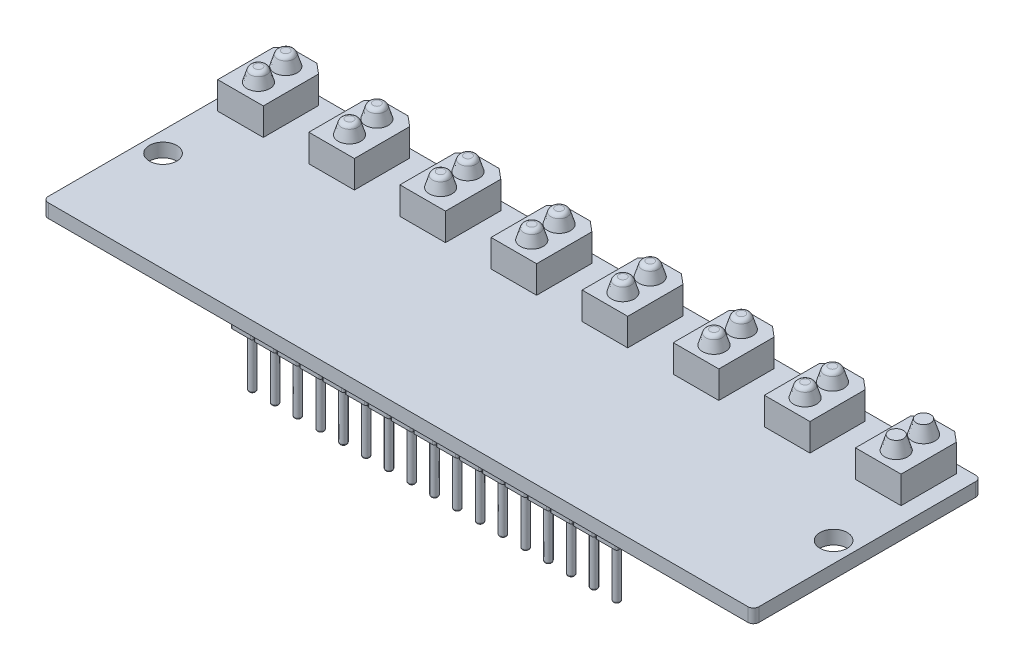
from build123d import *

# Parameters (mm, degrees)
SKETCH1_W                      = 78
SKETCH1_H                      = 25
BOSS_EXTRUDE1_DEPTH            = 1.5
FILLET1_R                      = 0.6
SKETCH2_R                      = 1.5
CUT_EXTRUDE1_DEPTH             = 1.5
BOSS_EXTRUDE2_DEPTH            = 3
SKETCH4_R                      = 1.25
BOSS_EXTRUDE7_DEPTH            = 1.5
BOSS_EXTRUDE7_DRAFT            = 17
BOSS_EXTRUDE7_PROFILE_2_DEPTH  = 1.5
BOSS_EXTRUDE7_PROFILE_2_DRAFT  = 17
BOSS_EXTRUDE7_PROFILE_3_DEPTH  = 1.5
BOSS_EXTRUDE7_PROFILE_3_DRAFT  = 17
BOSS_EXTRUDE7_PROFILE_4_DEPTH  = 1.5
BOSS_EXTRUDE7_PROFILE_4_DRAFT  = 17
BOSS_EXTRUDE7_PROFILE_5_DEPTH  = 1.5
BOSS_EXTRUDE7_PROFILE_5_DRAFT  = 17
BOSS_EXTRUDE7_PROFILE_6_DEPTH  = 1.5
BOSS_EXTRUDE7_PROFILE_6_DRAFT  = 17
BOSS_EXTRUDE7_PROFILE_7_DEPTH  = 1.5
BOSS_EXTRUDE7_PROFILE_7_DRAFT  = 17
BOSS_EXTRUDE7_PROFILE_8_DEPTH  = 1.5
BOSS_EXTRUDE7_PROFILE_8_DRAFT  = 17
BOSS_EXTRUDE7_PROFILE_9_DEPTH  = 1.5
BOSS_EXTRUDE7_PROFILE_9_DRAFT  = 17
BOSS_EXTRUDE7_PROFILE_10_DEPTH = 1.5
BOSS_EXTRUDE7_PROFILE_10_DRAFT = 17
BOSS_EXTRUDE7_PROFILE_11_DEPTH = 1.5
BOSS_EXTRUDE7_PROFILE_11_DRAFT = 17
BOSS_EXTRUDE7_PROFILE_12_DEPTH = 1.5
BOSS_EXTRUDE7_PROFILE_12_DRAFT = 17
BOSS_EXTRUDE7_PROFILE_13_DEPTH = 1.5
BOSS_EXTRUDE7_PROFILE_13_DRAFT = 17
BOSS_EXTRUDE7_PROFILE_14_DEPTH = 1.5
BOSS_EXTRUDE7_PROFILE_14_DRAFT = 17
BOSS_EXTRUDE7_PROFILE_15_DEPTH = 1.5
BOSS_EXTRUDE7_PROFILE_15_DRAFT = 17
BOSS_EXTRUDE7_PROFILE_16_DEPTH = 1.5
BOSS_EXTRUDE7_PROFILE_16_DRAFT = 17
FILLET4_R                      = 0.5
SKETCH5_W                      = 2.4
SKETCH5_H                      = 2.4
BOSS_EXTRUDE12_DEPTH           = 2
SKETCH6_R                      = 0.375
BOSS_EXTRUDE13_DEPTH           = 6
FILLET5_R                      = 0.2
FILLET7_R                      = 0.2
FILLET8_R                      = 0.2


with BuildPart() as part:
    # Sketch1 → Boss-Extrude1 (new body)
    with BuildSketch(Plane(origin=(0, 0, 0), x_dir=(1, 0, 0), z_dir=(0, 1, 0))):
        Rectangle(SKETCH1_W, SKETCH1_H)
    extrude(amount=BOSS_EXTRUDE1_DEPTH)

    # Fillet1
    fillet1_edges = [part.edges().sort_by_distance(p)[0] for p in [
        (-39, 0.75, -12.5),
        (39, 0.75, -12.5),
        (39, 0.75, 12.5),
        (-39, 0.75, 12.5),
    ]]
    fillet(fillet1_edges, radius=FILLET1_R)

    # Sketch2 → Cut-Extrude1 (cut)
    with BuildSketch(Plane(origin=(0, 1.5, 0), x_dir=(1, 0, 0), z_dir=(0, 1, 0))):
        with Locations(Location((-36.8, -1.5, 0), (0, 0, 270))):
            Circle(SKETCH2_R)
        with Locations(Location((36.8, -1.5, 0), (0, 0, 90))):
            Circle(SKETCH2_R)
    extrude(amount=-CUT_EXTRUDE1_DEPTH, mode=Mode.SUBTRACT)

    # Sketch3 → Boss-Extrude2 (add)
    with BuildSketch(Plane(origin=(0, 1.5, 0), x_dir=(1, 0, 0), z_dir=(0, 1, 0))):
        Polygon((-36.866761268, 12.5), (-33.913958089, 12.5), (-32.8, 11.566761268), (-32.8, 5.5), (-37.8, 5.5), (-37.8, 11.566761268), align=None)
        Polygon((-22.8, 11.566761268), (-22.8, 5.5), (-27.8, 5.5), (-27.8, 11.566761268), (-26.866761268, 12.5), (-23.913958089, 12.5), align=None)
        Polygon((-12.8, 11.566761268), (-12.8, 5.5), (-17.8, 5.5), (-17.8, 11.566761268), (-16.866761268, 12.5), (-13.913958089, 12.5), align=None)
        Polygon((-2.8, 11.566761268), (-2.8, 5.5), (-7.8, 5.5), (-7.8, 11.566761268), (-6.866761268, 12.5), (-3.913958089, 12.5), align=None)
        Polygon((7.2, 11.566761268), (7.2, 5.5), (2.2, 5.5), (2.2, 11.566761268), (3.133238732, 12.5), (6.086041911, 12.5), align=None)
        Polygon((17.2, 11.566761268), (17.2, 5.5), (12.2, 5.5), (12.2, 11.566761268), (13.133238732, 12.5), (16.086041911, 12.5), align=None)
        Polygon((27.2, 11.566761268), (27.2, 5.5), (22.2, 5.5), (22.2, 11.566761268), (23.133238732, 12.5), (26.086041911, 12.5), align=None)
        Polygon((37.2, 11.566761268), (37.2, 5.5), (32.2, 5.5), (32.2, 11.566761268), (33.133238732, 12.5), (36.086041911, 12.5), align=None)
    extrude(amount=BOSS_EXTRUDE2_DEPTH)


with BuildPart() as boss_extrude7_tool:
    # Sketch4 → Boss-Extrude7 (with draft: the straight prism first)
    with BuildSketch(Plane(origin=(0, 4.5, 0), x_dir=(1, 0, 0), z_dir=(0, 1, 0))):
        with Locations((-35.33, 10.499601384)):
            Circle(SKETCH4_R)
    extrude(amount=BOSS_EXTRUDE7_DEPTH)
    # Boss-Extrude7: the draft: its side faces are tilted about the plane it starts from
    boss_extrude7_sides = [boss_extrude7_tool.faces().sort_by_distance(p)[0] for p in [
        (-36.58, 5.25, -10.499601384),
    ]]
    draft(boss_extrude7_sides, Plane(origin=(0, 4.5, 0), x_dir=(1, 0, 0), z_dir=(0, 1, 0)), BOSS_EXTRUDE7_DRAFT)


with BuildPart() as part_1:
    add(part.part)

    # Boss-Extrude7: add boss_extrude7_tool
    add(boss_extrude7_tool.part)


with BuildPart() as boss_extrude7_profile_2_tool:
    # Sketch4 → Boss-Extrude7 profile 2 (with draft: the straight prism first)
    with BuildSketch(Plane(origin=(0, 4.5, 0), x_dir=(1, 0, 0), z_dir=(0, 1, 0))):
        with Locations((-35.33, 7.5)):
            Circle(SKETCH4_R)
    extrude(amount=BOSS_EXTRUDE7_PROFILE_2_DEPTH)
    # Boss-Extrude7 profile 2: the draft: its side faces are tilted about the plane it starts from
    boss_extrude7_profile_2_sides = [boss_extrude7_profile_2_tool.faces().sort_by_distance(p)[0] for p in [
        (-36.58, 5.25, -7.5),
    ]]
    draft(boss_extrude7_profile_2_sides, Plane(origin=(0, 4.5, 0), x_dir=(1, 0, 0), z_dir=(0, 1, 0)), BOSS_EXTRUDE7_PROFILE_2_DRAFT)


with BuildPart() as part_2:
    add(part_1.part)

    # Boss-Extrude7 profile 2: add boss_extrude7_profile_2_tool
    add(boss_extrude7_profile_2_tool.part)


with BuildPart() as boss_extrude7_profile_3_tool:
    # Sketch4 → Boss-Extrude7 profile 3 (with draft: the straight prism first)
    with BuildSketch(Plane(origin=(0, 4.5, 0), x_dir=(1, 0, 0), z_dir=(0, 1, 0))):
        with Locations((-25.33, 10.499601384)):
            Circle(SKETCH4_R)
    extrude(amount=BOSS_EXTRUDE7_PROFILE_3_DEPTH)
    # Boss-Extrude7 profile 3: the draft: its side faces are tilted about the plane it starts from
    boss_extrude7_profile_3_sides = [boss_extrude7_profile_3_tool.faces().sort_by_distance(p)[0] for p in [
        (-26.58, 5.25, -10.499601384),
    ]]
    draft(boss_extrude7_profile_3_sides, Plane(origin=(0, 4.5, 0), x_dir=(1, 0, 0), z_dir=(0, 1, 0)), BOSS_EXTRUDE7_PROFILE_3_DRAFT)


with BuildPart() as part_3:
    add(part_2.part)

    # Boss-Extrude7 profile 3: add boss_extrude7_profile_3_tool
    add(boss_extrude7_profile_3_tool.part)


with BuildPart() as boss_extrude7_profile_4_tool:
    # Sketch4 → Boss-Extrude7 profile 4 (with draft: the straight prism first)
    with BuildSketch(Plane(origin=(0, 4.5, 0), x_dir=(1, 0, 0), z_dir=(0, 1, 0))):
        with Locations((-25.33, 7.5)):
            Circle(SKETCH4_R)
    extrude(amount=BOSS_EXTRUDE7_PROFILE_4_DEPTH)
    # Boss-Extrude7 profile 4: the draft: its side faces are tilted about the plane it starts from
    boss_extrude7_profile_4_sides = [boss_extrude7_profile_4_tool.faces().sort_by_distance(p)[0] for p in [
        (-26.58, 5.25, -7.5),
    ]]
    draft(boss_extrude7_profile_4_sides, Plane(origin=(0, 4.5, 0), x_dir=(1, 0, 0), z_dir=(0, 1, 0)), BOSS_EXTRUDE7_PROFILE_4_DRAFT)


with BuildPart() as part_4:
    add(part_3.part)

    # Boss-Extrude7 profile 4: add boss_extrude7_profile_4_tool
    add(boss_extrude7_profile_4_tool.part)


with BuildPart() as boss_extrude7_profile_5_tool:
    # Sketch4 → Boss-Extrude7 profile 5 (with draft: the straight prism first)
    with BuildSketch(Plane(origin=(0, 4.5, 0), x_dir=(1, 0, 0), z_dir=(0, 1, 0))):
        with Locations((-15.33, 10.499601384)):
            Circle(SKETCH4_R)
    extrude(amount=BOSS_EXTRUDE7_PROFILE_5_DEPTH)
    # Boss-Extrude7 profile 5: the draft: its side faces are tilted about the plane it starts from
    boss_extrude7_profile_5_sides = [boss_extrude7_profile_5_tool.faces().sort_by_distance(p)[0] for p in [
        (-16.58, 5.25, -10.499601384),
    ]]
    draft(boss_extrude7_profile_5_sides, Plane(origin=(0, 4.5, 0), x_dir=(1, 0, 0), z_dir=(0, 1, 0)), BOSS_EXTRUDE7_PROFILE_5_DRAFT)


with BuildPart() as part_5:
    add(part_4.part)

    # Boss-Extrude7 profile 5: add boss_extrude7_profile_5_tool
    add(boss_extrude7_profile_5_tool.part)


with BuildPart() as boss_extrude7_profile_6_tool:
    # Sketch4 → Boss-Extrude7 profile 6 (with draft: the straight prism first)
    with BuildSketch(Plane(origin=(0, 4.5, 0), x_dir=(1, 0, 0), z_dir=(0, 1, 0))):
        with Locations((-15.33, 7.5)):
            Circle(SKETCH4_R)
    extrude(amount=BOSS_EXTRUDE7_PROFILE_6_DEPTH)
    # Boss-Extrude7 profile 6: the draft: its side faces are tilted about the plane it starts from
    boss_extrude7_profile_6_sides = [boss_extrude7_profile_6_tool.faces().sort_by_distance(p)[0] for p in [
        (-16.58, 5.25, -7.5),
    ]]
    draft(boss_extrude7_profile_6_sides, Plane(origin=(0, 4.5, 0), x_dir=(1, 0, 0), z_dir=(0, 1, 0)), BOSS_EXTRUDE7_PROFILE_6_DRAFT)


with BuildPart() as part_6:
    add(part_5.part)

    # Boss-Extrude7 profile 6: add boss_extrude7_profile_6_tool
    add(boss_extrude7_profile_6_tool.part)


with BuildPart() as boss_extrude7_profile_7_tool:
    # Sketch4 → Boss-Extrude7 profile 7 (with draft: the straight prism first)
    with BuildSketch(Plane(origin=(0, 4.5, 0), x_dir=(1, 0, 0), z_dir=(0, 1, 0))):
        with Locations((-5.33, 10.499601384)):
            Circle(SKETCH4_R)
    extrude(amount=BOSS_EXTRUDE7_PROFILE_7_DEPTH)
    # Boss-Extrude7 profile 7: the draft: its side faces are tilted about the plane it starts from
    boss_extrude7_profile_7_sides = [boss_extrude7_profile_7_tool.faces().sort_by_distance(p)[0] for p in [
        (-6.58, 5.25, -10.499601384),
    ]]
    draft(boss_extrude7_profile_7_sides, Plane(origin=(0, 4.5, 0), x_dir=(1, 0, 0), z_dir=(0, 1, 0)), BOSS_EXTRUDE7_PROFILE_7_DRAFT)


with BuildPart() as part_7:
    add(part_6.part)

    # Boss-Extrude7 profile 7: add boss_extrude7_profile_7_tool
    add(boss_extrude7_profile_7_tool.part)


with BuildPart() as boss_extrude7_profile_8_tool:
    # Sketch4 → Boss-Extrude7 profile 8 (with draft: the straight prism first)
    with BuildSketch(Plane(origin=(0, 4.5, 0), x_dir=(1, 0, 0), z_dir=(0, 1, 0))):
        with Locations((-5.33, 7.5)):
            Circle(SKETCH4_R)
    extrude(amount=BOSS_EXTRUDE7_PROFILE_8_DEPTH)
    # Boss-Extrude7 profile 8: the draft: its side faces are tilted about the plane it starts from
    boss_extrude7_profile_8_sides = [boss_extrude7_profile_8_tool.faces().sort_by_distance(p)[0] for p in [
        (-6.58, 5.25, -7.5),
    ]]
    draft(boss_extrude7_profile_8_sides, Plane(origin=(0, 4.5, 0), x_dir=(1, 0, 0), z_dir=(0, 1, 0)), BOSS_EXTRUDE7_PROFILE_8_DRAFT)


with BuildPart() as part_8:
    add(part_7.part)

    # Boss-Extrude7 profile 8: add boss_extrude7_profile_8_tool
    add(boss_extrude7_profile_8_tool.part)


with BuildPart() as boss_extrude7_profile_9_tool:
    # Sketch4 → Boss-Extrude7 profile 9 (with draft: the straight prism first)
    with BuildSketch(Plane(origin=(0, 4.5, 0), x_dir=(1, 0, 0), z_dir=(0, 1, 0))):
        with Locations((4.67, 10.499601384)):
            Circle(SKETCH4_R)
    extrude(amount=BOSS_EXTRUDE7_PROFILE_9_DEPTH)
    # Boss-Extrude7 profile 9: the draft: its side faces are tilted about the plane it starts from
    boss_extrude7_profile_9_sides = [boss_extrude7_profile_9_tool.faces().sort_by_distance(p)[0] for p in [
        (3.42, 5.25, -10.499601384),
    ]]
    draft(boss_extrude7_profile_9_sides, Plane(origin=(0, 4.5, 0), x_dir=(1, 0, 0), z_dir=(0, 1, 0)), BOSS_EXTRUDE7_PROFILE_9_DRAFT)


with BuildPart() as part_9:
    add(part_8.part)

    # Boss-Extrude7 profile 9: add boss_extrude7_profile_9_tool
    add(boss_extrude7_profile_9_tool.part)


with BuildPart() as boss_extrude7_profile_10_tool:
    # Sketch4 → Boss-Extrude7 profile 10 (with draft: the straight prism first)
    with BuildSketch(Plane(origin=(0, 4.5, 0), x_dir=(1, 0, 0), z_dir=(0, 1, 0))):
        with Locations((4.67, 7.5)):
            Circle(SKETCH4_R)
    extrude(amount=BOSS_EXTRUDE7_PROFILE_10_DEPTH)
    # Boss-Extrude7 profile 10: the draft: its side faces are tilted about the plane it starts from
    boss_extrude7_profile_10_sides = [boss_extrude7_profile_10_tool.faces().sort_by_distance(p)[0] for p in [
        (3.42, 5.25, -7.5),
    ]]
    draft(boss_extrude7_profile_10_sides, Plane(origin=(0, 4.5, 0), x_dir=(1, 0, 0), z_dir=(0, 1, 0)), BOSS_EXTRUDE7_PROFILE_10_DRAFT)


with BuildPart() as part_10:
    add(part_9.part)

    # Boss-Extrude7 profile 10: add boss_extrude7_profile_10_tool
    add(boss_extrude7_profile_10_tool.part)


with BuildPart() as boss_extrude7_profile_11_tool:
    # Sketch4 → Boss-Extrude7 profile 11 (with draft: the straight prism first)
    with BuildSketch(Plane(origin=(0, 4.5, 0), x_dir=(1, 0, 0), z_dir=(0, 1, 0))):
        with Locations((14.67, 10.499601384)):
            Circle(SKETCH4_R)
    extrude(amount=BOSS_EXTRUDE7_PROFILE_11_DEPTH)
    # Boss-Extrude7 profile 11: the draft: its side faces are tilted about the plane it starts from
    boss_extrude7_profile_11_sides = [boss_extrude7_profile_11_tool.faces().sort_by_distance(p)[0] for p in [
        (13.42, 5.25, -10.499601384),
    ]]
    draft(boss_extrude7_profile_11_sides, Plane(origin=(0, 4.5, 0), x_dir=(1, 0, 0), z_dir=(0, 1, 0)), BOSS_EXTRUDE7_PROFILE_11_DRAFT)


with BuildPart() as part_11:
    add(part_10.part)

    # Boss-Extrude7 profile 11: add boss_extrude7_profile_11_tool
    add(boss_extrude7_profile_11_tool.part)


with BuildPart() as boss_extrude7_profile_12_tool:
    # Sketch4 → Boss-Extrude7 profile 12 (with draft: the straight prism first)
    with BuildSketch(Plane(origin=(0, 4.5, 0), x_dir=(1, 0, 0), z_dir=(0, 1, 0))):
        with Locations((14.67, 7.5)):
            Circle(SKETCH4_R)
    extrude(amount=BOSS_EXTRUDE7_PROFILE_12_DEPTH)
    # Boss-Extrude7 profile 12: the draft: its side faces are tilted about the plane it starts from
    boss_extrude7_profile_12_sides = [boss_extrude7_profile_12_tool.faces().sort_by_distance(p)[0] for p in [
        (13.42, 5.25, -7.5),
    ]]
    draft(boss_extrude7_profile_12_sides, Plane(origin=(0, 4.5, 0), x_dir=(1, 0, 0), z_dir=(0, 1, 0)), BOSS_EXTRUDE7_PROFILE_12_DRAFT)


with BuildPart() as part_12:
    add(part_11.part)

    # Boss-Extrude7 profile 12: add boss_extrude7_profile_12_tool
    add(boss_extrude7_profile_12_tool.part)


with BuildPart() as boss_extrude7_profile_13_tool:
    # Sketch4 → Boss-Extrude7 profile 13 (with draft: the straight prism first)
    with BuildSketch(Plane(origin=(0, 4.5, 0), x_dir=(1, 0, 0), z_dir=(0, 1, 0))):
        with Locations((24.67, 10.499601384)):
            Circle(SKETCH4_R)
    extrude(amount=BOSS_EXTRUDE7_PROFILE_13_DEPTH)
    # Boss-Extrude7 profile 13: the draft: its side faces are tilted about the plane it starts from
    boss_extrude7_profile_13_sides = [boss_extrude7_profile_13_tool.faces().sort_by_distance(p)[0] for p in [
        (23.42, 5.25, -10.499601384),
    ]]
    draft(boss_extrude7_profile_13_sides, Plane(origin=(0, 4.5, 0), x_dir=(1, 0, 0), z_dir=(0, 1, 0)), BOSS_EXTRUDE7_PROFILE_13_DRAFT)


with BuildPart() as part_13:
    add(part_12.part)

    # Boss-Extrude7 profile 13: add boss_extrude7_profile_13_tool
    add(boss_extrude7_profile_13_tool.part)


with BuildPart() as boss_extrude7_profile_14_tool:
    # Sketch4 → Boss-Extrude7 profile 14 (with draft: the straight prism first)
    with BuildSketch(Plane(origin=(0, 4.5, 0), x_dir=(1, 0, 0), z_dir=(0, 1, 0))):
        with Locations((24.67, 7.5)):
            Circle(SKETCH4_R)
    extrude(amount=BOSS_EXTRUDE7_PROFILE_14_DEPTH)
    # Boss-Extrude7 profile 14: the draft: its side faces are tilted about the plane it starts from
    boss_extrude7_profile_14_sides = [boss_extrude7_profile_14_tool.faces().sort_by_distance(p)[0] for p in [
        (23.42, 5.25, -7.5),
    ]]
    draft(boss_extrude7_profile_14_sides, Plane(origin=(0, 4.5, 0), x_dir=(1, 0, 0), z_dir=(0, 1, 0)), BOSS_EXTRUDE7_PROFILE_14_DRAFT)


with BuildPart() as part_14:
    add(part_13.part)

    # Boss-Extrude7 profile 14: add boss_extrude7_profile_14_tool
    add(boss_extrude7_profile_14_tool.part)


with BuildPart() as boss_extrude7_profile_15_tool:
    # Sketch4 → Boss-Extrude7 profile 15 (with draft: the straight prism first)
    with BuildSketch(Plane(origin=(0, 4.5, 0), x_dir=(1, 0, 0), z_dir=(0, 1, 0))):
        with Locations((34.67, 10.499601384)):
            Circle(SKETCH4_R)
    extrude(amount=BOSS_EXTRUDE7_PROFILE_15_DEPTH)
    # Boss-Extrude7 profile 15: the draft: its side faces are tilted about the plane it starts from
    boss_extrude7_profile_15_sides = [boss_extrude7_profile_15_tool.faces().sort_by_distance(p)[0] for p in [
        (33.42, 5.25, -10.499601384),
    ]]
    draft(boss_extrude7_profile_15_sides, Plane(origin=(0, 4.5, 0), x_dir=(1, 0, 0), z_dir=(0, 1, 0)), BOSS_EXTRUDE7_PROFILE_15_DRAFT)


with BuildPart() as part_15:
    add(part_14.part)

    # Boss-Extrude7 profile 15: add boss_extrude7_profile_15_tool
    add(boss_extrude7_profile_15_tool.part)


with BuildPart() as boss_extrude7_profile_16_tool:
    # Sketch4 → Boss-Extrude7 profile 16 (with draft: the straight prism first)
    with BuildSketch(Plane(origin=(0, 4.5, 0), x_dir=(1, 0, 0), z_dir=(0, 1, 0))):
        with Locations((34.67, 7.5)):
            Circle(SKETCH4_R)
    extrude(amount=BOSS_EXTRUDE7_PROFILE_16_DEPTH)
    # Boss-Extrude7 profile 16: the draft: its side faces are tilted about the plane it starts from
    boss_extrude7_profile_16_sides = [boss_extrude7_profile_16_tool.faces().sort_by_distance(p)[0] for p in [
        (33.42, 5.25, -7.5),
    ]]
    draft(boss_extrude7_profile_16_sides, Plane(origin=(0, 4.5, 0), x_dir=(1, 0, 0), z_dir=(0, 1, 0)), BOSS_EXTRUDE7_PROFILE_16_DRAFT)


with BuildPart() as part_16:
    add(part_15.part)

    # Boss-Extrude7 profile 16: add boss_extrude7_profile_16_tool
    add(boss_extrude7_profile_16_tool.part)

    # Fillet4
    fillet4_edges = [part_16.edges().sort_by_distance(p)[0] for p in [
        (-36.121403978, 6, -10.499601384),
        (-36.121403978, 6, -7.5),
        (-26.121403978, 6, -10.499601384),
        (-26.121403978, 6, -7.5),
        (-16.121403978, 6, -10.499601384),
        (-16.121403978, 6, -7.5),
        (-6.121403978, 6, -10.499601384),
        (-6.121403978, 6, -7.5),
        (3.878596022, 6, -10.499601384),
        (3.878596022, 6, -7.5),
        (13.878596022, 6, -10.499601384),
        (13.878596022, 6, -7.5),
        (23.878596022, 6, -10.499601384),
        (23.878596022, 6, -7.5),
    ]]
    fillet(fillet4_edges, radius=FILLET4_R)

    # Sketch5 → Boss-Extrude12 (add)
    with BuildSketch(Plane.XZ):
        with Locations((-16.3, 9.7)):
            Rectangle(SKETCH5_W, SKETCH5_H)
        with Locations((-13.8, 9.7)):
            Rectangle(SKETCH5_W, SKETCH5_H)
        with Locations((-11.3, 9.7)):
            Rectangle(SKETCH5_W, SKETCH5_H)
        with Locations((-8.8, 9.7)):
            Rectangle(SKETCH5_W, SKETCH5_H)
        with Locations((-6.3, 9.7)):
            Rectangle(SKETCH5_W, SKETCH5_H)
        with Locations((-18.8, 9.7)):
            Rectangle(SKETCH5_W, SKETCH5_H)
        with Locations((-3.8, 9.7)):
            Rectangle(SKETCH5_W, SKETCH5_H)
        with Locations((-1.3, 9.7)):
            Rectangle(SKETCH5_W, SKETCH5_H)
        with Locations((1.2, 9.7)):
            Rectangle(SKETCH5_W, SKETCH5_H)
        with Locations((3.7, 9.7)):
            Rectangle(SKETCH5_W, SKETCH5_H)
        with Locations((6.2, 9.7)):
            Rectangle(SKETCH5_W, SKETCH5_H)
        with Locations((8.7, 9.7)):
            Rectangle(SKETCH5_W, SKETCH5_H)
        with Locations((11.2, 9.7)):
            Rectangle(SKETCH5_W, SKETCH5_H)
        with Locations((13.7, 9.7)):
            Rectangle(SKETCH5_W, SKETCH5_H)
        with Locations((16.2, 9.7)):
            Rectangle(SKETCH5_W, SKETCH5_H)
        with Locations((18.7, 9.7)):
            Rectangle(SKETCH5_W, SKETCH5_H)
        with Locations((21.2, 9.7)):
            Rectangle(SKETCH5_W, SKETCH5_H)
    extrude(amount=BOSS_EXTRUDE12_DEPTH)

    # Sketch6 → Boss-Extrude13 (add)
    with BuildSketch(Plane.XZ.offset(2)):
        with Locations(Location((-18.8, 9.7, 0), (0, 0, 270))):
            Circle(SKETCH6_R)
        with Locations(Location((-16.3, 9.7, 0), (0, 0, 270))):
            Circle(SKETCH6_R)
        with Locations(Location((-13.8, 9.7, 0), (0, 0, 270))):
            Circle(SKETCH6_R)
        with Locations(Location((-11.3, 9.7, 0), (0, 0, 270))):
            Circle(SKETCH6_R)
        with Locations(Location((-8.8, 9.7, 0), (0, 0, 270))):
            Circle(SKETCH6_R)
        with Locations(Location((-6.3, 9.7, 0), (0, 0, 270))):
            Circle(SKETCH6_R)
        with Locations(Location((-3.8, 9.7, 0), (0, 0, 270))):
            Circle(SKETCH6_R)
        with Locations(Location((-1.3, 9.7, 0), (0, 0, 270))):
            Circle(SKETCH6_R)
        with Locations(Location((1.2, 9.7, 0), (0, 0, 270))):
            Circle(SKETCH6_R)
        with Locations(Location((3.7, 9.7, 0), (0, 0, 270))):
            Circle(SKETCH6_R)
        with Locations(Location((6.2, 9.7, 0), (0, 0, 270))):
            Circle(SKETCH6_R)
        with Locations(Location((8.7, 9.7, 0), (0, 0, 270))):
            Circle(SKETCH6_R)
        with Locations(Location((11.2, 9.7, 0), (0, 0, 270))):
            Circle(SKETCH6_R)
        with Locations(Location((13.7, 9.7, 0), (0, 0, 270))):
            Circle(SKETCH6_R)
        with Locations(Location((16.2, 9.7, 0), (0, 0, 270))):
            Circle(SKETCH6_R)
        with Locations(Location((18.7, 9.7, 0), (0, 0, 270))):
            Circle(SKETCH6_R)
        with Locations(Location((21.2, 9.7, 0), (0, 0, 270))):
            Circle(SKETCH6_R)
    extrude(amount=BOSS_EXTRUDE13_DEPTH)

    # Fillet5
    fillet5_edges = [part_16.edges().sort_by_distance(p)[0] for p in [
        (-17.6, -1, 10.9),
        (-20, -1, 10.9),
        (-20, -1, 8.5),
        (-17.6, -1, 8.5),
    ]]
    fillet(fillet5_edges, radius=FILLET5_R)

    # Fillet7
    fillet7_edges = [part_16.edges().sort_by_distance(p)[0] for p in [
        (-15.1, -1, 10.9),
        (-17.5, -1, 10.9),
        (-17.5, -1, 8.5),
        (-15.1, -1, 8.5),
        (-12.6, -1, 10.9),
        (-15, -1, 10.9),
        (-15, -1, 8.5),
        (-12.6, -1, 8.5),
        (-10.1, -1, 10.9),
        (-12.5, -1, 10.9),
        (-12.5, -1, 8.5),
        (-10.1, -1, 8.5),
        (-7.6, -1, 10.9),
        (-10, -1, 10.9),
        (-10, -1, 8.5),
        (-7.6, -1, 8.5),
        (-5.1, -1, 10.9),
        (-7.5, -1, 10.9),
        (-7.5, -1, 8.5),
        (-5.1, -1, 8.5),
        (-2.6, -1, 10.9),
        (-5, -1, 10.9),
        (-5, -1, 8.5),
        (-2.6, -1, 8.5),
        (-0.1, -1, 10.9),
        (-2.5, -1, 10.9),
        (-2.5, -1, 8.5),
        (-0.1, -1, 8.5),
        (2.4, -1, 10.9),
        (0, -1, 10.9),
        (0, -1, 8.5),
        (2.4, -1, 8.5),
        (4.9, -1, 10.9),
        (2.5, -1, 10.9),
        (2.5, -1, 8.5),
        (4.9, -1, 8.5),
        (7.4, -1, 10.9),
        (5, -1, 10.9),
        (5, -1, 8.5),
        (7.4, -1, 8.5),
        (9.9, -1, 10.9),
        (7.5, -1, 10.9),
        (7.5, -1, 8.5),
        (9.9, -1, 8.5),
        (12.4, -1, 10.9),
        (10, -1, 10.9),
        (10, -1, 8.5),
        (12.4, -1, 8.5),
        (14.9, -1, 10.9),
        (12.5, -1, 10.9),
        (12.5, -1, 8.5),
        (14.9, -1, 8.5),
        (17.4, -1, 10.9),
        (15, -1, 10.9),
        (15, -1, 8.5),
        (17.4, -1, 8.5),
        (19.9, -1, 10.9),
        (17.5, -1, 10.9),
        (17.5, -1, 8.5),
        (19.9, -1, 8.5),
        (22.4, -1, 10.9),
        (20, -1, 10.9),
        (20, -1, 8.5),
        (22.4, -1, 8.5),
    ]]
    fillet(fillet7_edges, radius=FILLET7_R)

    # Fillet8
    fillet8_edges = [part_16.edges().sort_by_distance(p)[0] for p in [
        (-18.8, -8, 10.075),
        (-16.3, -8, 10.075),
        (-13.8, -8, 10.075),
        (-11.3, -8, 10.075),
        (-8.8, -8, 10.075),
        (-6.3, -8, 10.075),
        (-3.8, -8, 10.075),
        (-1.3, -8, 10.075),
        (1.2, -8, 10.075),
        (3.7, -8, 10.075),
        (6.2, -8, 10.075),
        (8.7, -8, 10.075),
        (11.2, -8, 10.075),
        (13.7, -8, 10.075),
        (16.2, -8, 10.075),
        (18.7, -8, 10.075),
        (21.2, -8, 10.075),
    ]]
    fillet(fillet8_edges, radius=FILLET8_R)


solid = part_16.part
